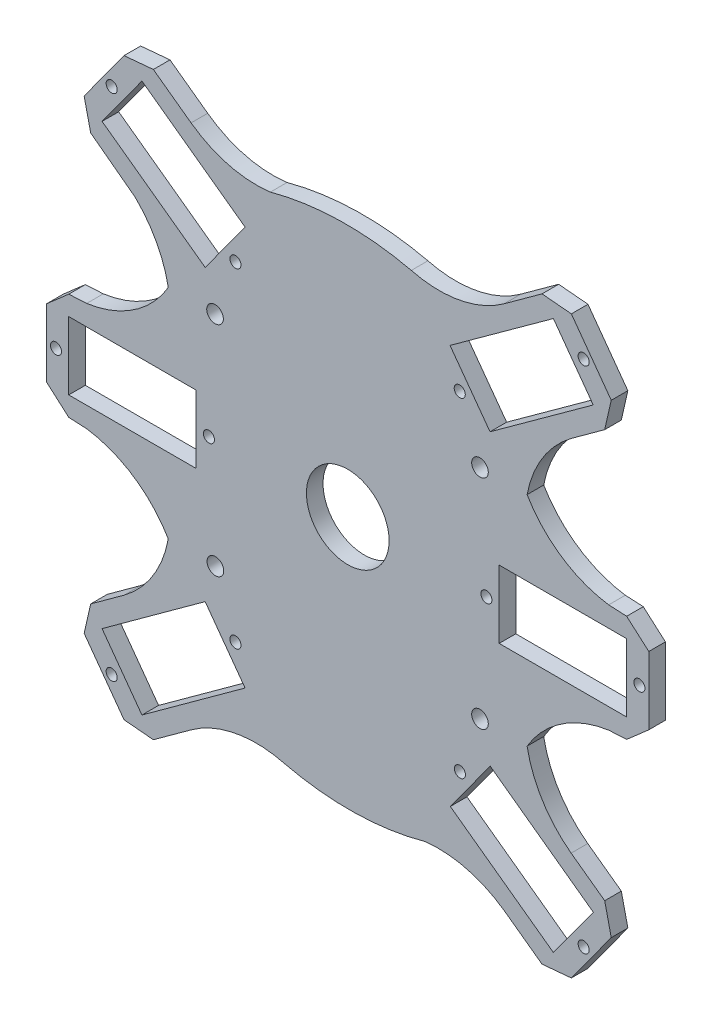
from build123d import *

# Parameters (mm, degrees)
BOSS_EXTRUDE1_DEPTH = 3
SKETCH2_W           = 23
SKETCH2_H           = 12.24
CUT_EXTRUDE1_DEPTH  = 3
SKETCH3_R           = 7.46
SKETCH3_R_2         = 1
CUT_EXTRUDE2_DEPTH  = 3
SKETCH4_R           = 1.5
CUT_EXTRUDE4_DEPTH  = 3


with BuildPart() as part:
    # Sketch1 → Boss-Extrude1 (new body)
    with BuildSketch(Plane.XY):
        with BuildLine():
            Line((82.647113629, 154.567509506), (89.844393112, 164.473715786))
            Line((89.844393112, 164.473715786), (95.137710251, 164.954136674))
            Line((95.137710251, 164.954136674), (101.943215616, 160.009648062))
            ThreePointArc((101.943215616, 160.009648062), (108.747642501, 156.812557566), (116.251704746, 156.353577499))
            ThreePointArc((116.251704746, 156.353577499), (128.935389479, 158.162930803), (141.678042243, 156.830857858))
            ThreePointArc((141.678042243, 156.830857858), (150.42338057, 156.539561763), (158.456083243, 160.009645858))
            Line((158.456083243, 160.009645858), (165.261591353, 164.954136376))
            Line((165.261591353, 164.954136376), (170.55490849, 164.473715466))
            Line((170.55490849, 164.473715466), (177.752187889, 154.567509125))
            Line((177.752187889, 154.567509125), (176.573368159, 149.384810766))
            Line((176.573368159, 149.384810766), (170.515619404, 144.983599161))
            ThreePointArc((170.515619404, 144.983599161), (165.346551478, 139.353755533), (162.56771378, 132.23389152))
            ThreePointArc((162.56771378, 132.23389152), (168.807132787, 125.625610798), (177.296006603, 122.379267473))
            Line((177.296006603, 122.379267473), (180.529625637, 122.208660353))
            Line((180.529625637, 122.208660353), (184.529626293, 118.70866071))
            Line((184.529626293, 118.70866071), (184.529626293, 106.463914621))
            Line((184.529626293, 106.463914621), (180.529628861, 102.963911295))
            Line((180.529628861, 102.963911295), (177.296136644, 102.79331796))
            ThreePointArc((177.296136644, 102.79331796), (168.816865326, 99.532528302), (162.567726238, 92.938663582))
            ThreePointArc((162.567726238, 92.938663582), (165.335032155, 85.811599743), (170.515615031, 80.188915148))
            Line((170.515615031, 80.188915148), (176.573365794, 75.787706307))
            Line((176.573365794, 75.787706307), (177.752187889, 70.605008486))
            Line((177.752187889, 70.605008486), (170.55491301, 60.698798861))
            Line((170.55491301, 60.698798861), (165.261596092, 60.218375535))
            Line((165.261596092, 60.218375535), (158.456093799, 65.162857082))
            ThreePointArc((158.456093799, 65.162857082), (151.641647942, 68.320751195), (144.1475976, 68.818924897))
            ThreePointArc((144.1475976, 68.818924897), (131.464672299, 66.969153974), (118.721260324, 68.341632719))
            ThreePointArc((118.721260324, 68.341632719), (109.975917376, 68.632921623), (101.943212729, 65.162831055))
            Line((101.943212729, 65.162831055), (95.13771499, 60.21834324))
            Line((95.13771499, 60.21834324), (89.844397632, 60.698761712))
            Line((89.844397632, 60.698761712), (82.647113629, 70.604964708))
            Line((82.647113629, 70.604964708), (83.825933315, 75.787663077))
            Line((83.825933315, 75.787663077), (89.883680023, 80.188877497))
            ThreePointArc((89.883680023, 80.188877497), (95.064494698, 85.811419139), (97.831557073, 92.938633252))
            ThreePointArc((97.831557073, 92.938633252), (91.592138066, 99.546913975), (83.10326425, 102.7932573))
            Line((83.10326425, 102.7932573), (79.869645216, 102.96386442))
            Line((79.869645216, 102.96386442), (75.86964456, 106.463864062))
            Line((75.86964456, 106.463864062), (75.86964456, 118.708610151))
            Line((75.86964456, 118.708610151), (79.869645216, 122.208609794))
            Line((79.869645216, 122.208609794), (83.10313759, 122.37920015))
            ThreePointArc((83.10313759, 122.37920015), (91.594370453, 125.622109158), (97.831557073, 132.233840961))
            ThreePointArc((97.831557073, 132.233840961), (95.706766675, 138.255067903), (91.855628915, 143.348067616))
            Line((91.855628915, 143.348067616), (83.825933315, 149.384811137))
            Line((83.825933315, 149.384811137), (82.647113629, 154.567509506))
        make_face()
    extrude(amount=BOSS_EXTRUDE1_DEPTH)

    # Sketch2 → Cut-Extrude1 (cut)
    with BuildSketch(Plane.XY.offset(3)):
        Polygon((85.883180637, 152.216369421), (93.077671686, 162.118737751), (111.685063156, 148.599677772), (104.490572106, 138.697309442), align=None)
        Polygon((111.684568391, 76.57424171), (104.489714954, 86.476346739), (85.883095664, 72.956224001), (93.077671686, 63.054500773), align=None)
        with Locations((91.369645216, 112.588609794)):
            Rectangle(SKETCH2_W, SKETCH2_H)
        Polygon((167.318839084, 162.122576423), (174.502849909, 152.212602231), (155.881166379, 138.713235486), (148.664694499, 148.599677772), align=None)
        with Locations((169.029625637, 112.588609794)):
            Rectangle(SKETCH2_W, SKETCH2_H)
        Polygon((174.516118852, 72.956145779), (167.3172806, 63.056937335), (148.715826824, 76.584166078), (155.914665077, 86.483374522), align=None)
    extrude(amount=-CUT_EXTRUDE1_DEPTH, mode=Mode.SUBTRACT)

    # Sketch3 → Cut-Extrude2 (cut)
    with BuildSketch(Plane.XY.offset(3)):
        with Locations((130.211941481, 112.566154055)):
            Circle(SKETCH3_R)
        with Locations((87.619687014, 158.519459583)):
            Circle(SKETCH3_R_2)
        with Locations((109.948556778, 142.296587609)):
            Circle(SKETCH3_R_2)
        with Locations((172.773012849, 158.517526001)):
            Circle(SKETCH3_R_2)
        with Locations((150.415193897, 142.300427521)):
            Circle(SKETCH3_R_2)
        with Locations((182.829625637, 112.588609794)):
            Circle(SKETCH3_R_2)
        with Locations((155.229625637, 112.588609794)):
            Circle(SKETCH3_R_2)
        with Locations((105.169645216, 112.588609794)):
            Circle(SKETCH3_R_2)
        with Locations((77.567644425, 112.588609794)):
            Circle(SKETCH3_R_2)
        with Locations((109.947817472, 82.877287408)):
            Circle(SKETCH3_R_2)
        with Locations((87.619707876, 66.653369203)):
            Circle(SKETCH3_R_2)
        with Locations((172.776845103, 66.653818683)):
            Circle(SKETCH3_R_2)
        with Locations((150.455100573, 82.886493174)):
            Circle(SKETCH3_R_2)
    extrude(amount=-CUT_EXTRUDE2_DEPTH, mode=Mode.SUBTRACT)

    # Sketch4 → Cut-Extrude4 (cut)
    with BuildSketch(Plane.XY.offset(3)):
        with Locations((106.267728038, 132.297669996)):
            Circle(SKETCH4_R)
        with Locations((154.06771378, 132.23389152)):
            Circle(SKETCH4_R)
        with Locations((106.331557073, 92.938633252)):
            Circle(SKETCH4_R)
        with Locations((154.067726238, 92.938663582)):
            Circle(SKETCH4_R)
    extrude(amount=-CUT_EXTRUDE4_DEPTH, mode=Mode.SUBTRACT)


solid = part.part
